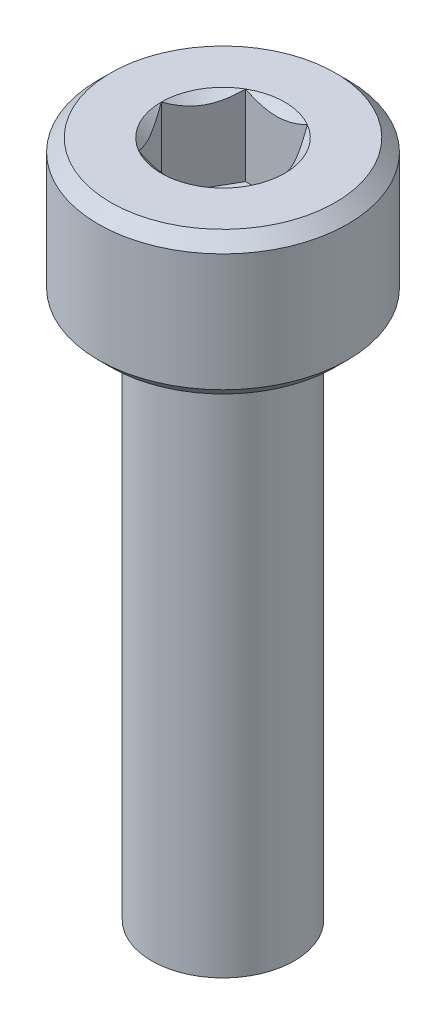
from build123d import *

# Parameters (mm, degrees)
SKETCH1_R           = 3.5
BOSS_EXTRUDE1_DEPTH = 4
CUT_EXTRUDE1_DEPTH  = 2.25
CHAMFER1_SIZE       = 0.35
SKETCH_1_R          = 2
EXTRUDE_1_DEPTH     = 15


with BuildPart() as part:
    # Sketch1 → Boss-Extrude1 (new body)
    with BuildSketch(Plane(origin=(0, 0, 0), x_dir=(1, 0, 0), z_dir=(0, 1, 0))):
        with Locations(Location((0, 0, 0), (0, 0, 270))):
            Circle(SKETCH1_R)
    extrude(amount=BOSS_EXTRUDE1_DEPTH)

    # Sketch2 → Cut-Extrude1 (cut)
    with BuildSketch(Plane(origin=(0, 4, 0), x_dir=(1, 0, 0), z_dir=(0, 1, 0))):
        Polygon((0.866025404, 1.5), (-0.866025404, 1.5), (-1.732050808, 0), (-0.866025404, -1.5), (0.866025404, -1.5), (1.732050808, 0), align=None)
    extrude(amount=-CUT_EXTRUDE1_DEPTH, mode=Mode.SUBTRACT)

    # Cut-Extrude2 cone 1 section (through the dimple's axis) → Cut-Extrude2 (revolve, cut)
    with BuildSketch(Plane(origin=(0, 4, 0), x_dir=(0, 0, 1), z_dir=(1, 0, 0))):
        Polygon((0, 0), (1.732050808, 0), (0, 1.732050808), align=None)
    revolve(axis=Axis((0, 4, 0), (0, -1, 0)), mode=Mode.SUBTRACT)

    # Chamfer1
    chamfer1_edges = [part.edges().sort_by_distance(p)[0] for p in [
        (0, 0, -3.5),
        (0, 4, -3.5),
    ]]
    chamfer(chamfer1_edges, length=CHAMFER1_SIZE)

    # 草图1 → 凸台-拉伸1 (add)
    with BuildSketch(Plane(origin=(0, 0, 0), x_dir=(-1, 0, 0), z_dir=(0, -1, 0))):
        with Locations(Location((0, 0, 0), (0, 0, 90))):
            Circle(SKETCH_1_R)
    extrude(amount=EXTRUDE_1_DEPTH)


solid = part.part
